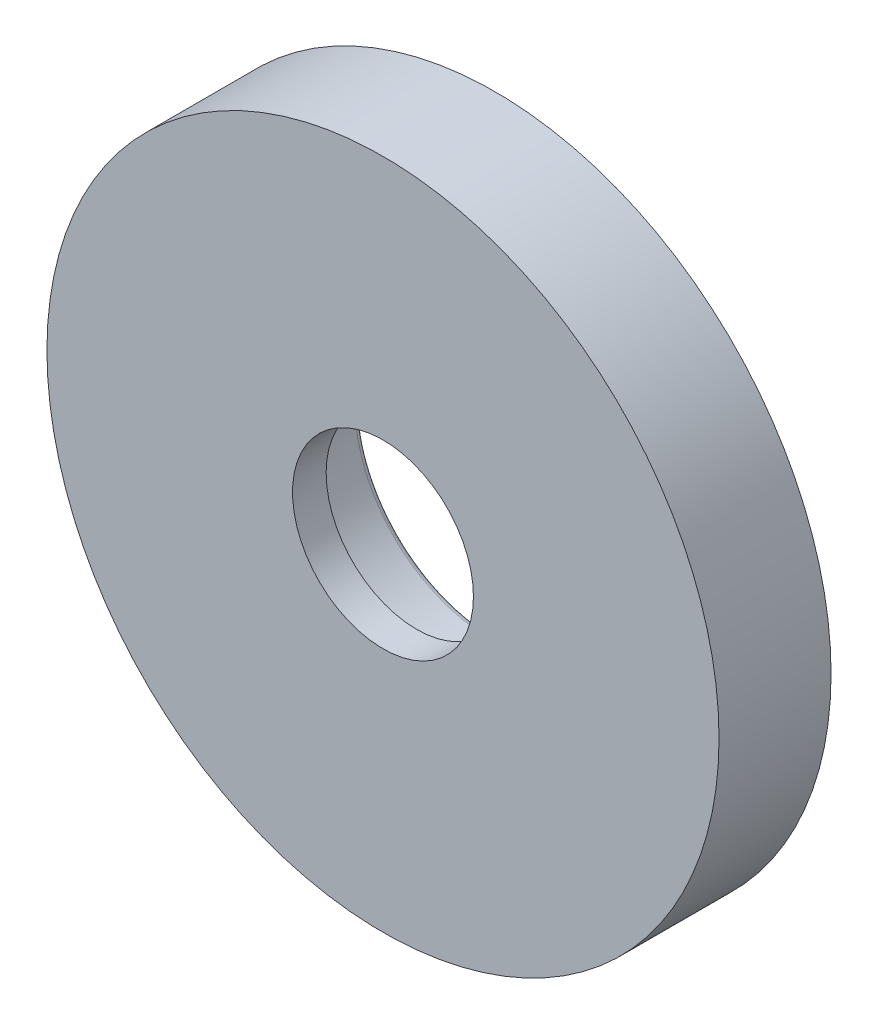
from build123d import *

# Parameters (mm, degrees)
SKETCH1_R               = 15
BOSS_EXTRUDE1_DEPTH     = 5
CUT_EXTRUDE1_DEPTH      = 3.125
BOSS_EXTRUDE4_START     = 3.125
BOSS_EXTRUDE4_DEPTH     = 3.125
CIRPATTERN1_COUNT       = 4
SKETCH4_R               = 6
CUT_EXTRUDE2_DEPTH      = 3.5
FILLET1_R               = 0.25
CUT_EXTRUDE3_DEPTH      = 22.794494718
CUT_EXTRUDE3_DEPTH_BACK = 22.794494718
SKETCH5_R               = 4.0375
FILLET2_R               = 0.5


with BuildPart() as part:
    # Sketch1 → Boss-Extrude1 (new body)
    with BuildSketch(Plane.XY):
        Circle(SKETCH1_R)
    extrude(amount=BOSS_EXTRUDE1_DEPTH)

    # Sketch1<5> → Cut-Extrude1 (cut)
    with BuildSketch(Plane.XY):
        with BuildLine():
            ThreePointArc((-2.469224322, 13.9075), (-4.680749466, 13.326897968), (-6.769624128, 12.397088939))
            Line((-6.769624128, 12.397088939), (-6.769624128, 8.9075))
            Line((-6.769624128, 8.9075), (6.769624128, 8.9075))
            Line((6.769624128, 8.9075), (6.769624128, 12.397088939))
            ThreePointArc((6.769624128, 12.397088939), (4.680749466, 13.326897968), (2.469224322, 13.9075))
            Line((2.469224322, 13.9075), (-2.469224322, 13.9075))
        make_face()
    cut_extrude1 = extrude(amount=CUT_EXTRUDE1_DEPTH, mode=Mode.SUBTRACT)

    # Sketch7 → Boss-Extrude4 (add)
    with BuildSketch(Plane(origin=(0, 0, 3.125), x_dir=(-1, 0, 0), z_dir=(0, 0, -1)).offset(BOSS_EXTRUDE4_START)):
        with BuildLine():
            ThreePointArc((-2.469224322, 13.9075), (-4.680749466, 13.326897968), (-6.769624128, 12.397088939))
            Line((-6.769624128, 12.397088939), (-6.769624128, 8.9075))
            Line((-6.769624128, 8.9075), (6.769624128, 8.9075))
            Line((6.769624128, 8.9075), (6.769624128, 12.397088939))
            ThreePointArc((6.769624128, 12.397088939), (4.680749466, 13.326897968), (2.469224322, 13.9075))
            Line((2.469224322, 13.9075), (-2.469224322, 13.9075))
        make_face()
        with BuildLine():
            Line((-6.644624128, 9.0325), (-6.644624128, 12.322701416))
            ThreePointArc((-6.644624128, 12.322701416), (-4.609561284, 13.219377624), (-2.45818912, 13.7825))
            Line((-2.45818912, 13.7825), (2.45818912, 13.7825))
            ThreePointArc((2.45818912, 13.7825), (4.609561284, 13.219377624), (6.644624128, 12.322701416))
            Line((6.644624128, 12.322701416), (6.644624128, 9.0325))
            Line((6.644624128, 9.0325), (-6.644624128, 9.0325))
        make_face(mode=Mode.SUBTRACT)
    boss_extrude4 = extrude(amount=-BOSS_EXTRUDE4_DEPTH)

    # CirPattern1: Cut-Extrude1, Boss-Extrude4 ×4 about axis
    cirpattern1_axis = Axis((0, 0, -0.25), (0, 0, 1))
    add([cut_extrude1.rotate(cirpattern1_axis, i * 360 / CIRPATTERN1_COUNT) for i in range(1, CIRPATTERN1_COUNT)], mode=Mode.SUBTRACT)
    add([boss_extrude4.rotate(cirpattern1_axis, i * 360 / CIRPATTERN1_COUNT) for i in range(1, CIRPATTERN1_COUNT)])

    # Sketch4 → Cut-Extrude2 (cut)
    with BuildSketch(Plane(origin=(0, 0, 0), x_dir=(-1, 0, 0), z_dir=(0, 0, -1))):
        Circle(SKETCH4_R)
    extrude(amount=-CUT_EXTRUDE2_DEPTH, mode=Mode.SUBTRACT)

    # Fillet1
    fillet1_edges = [part.edges().sort_by_distance(p)[0] for p in [
        (6, 0, 0),
    ]]
    fillet(fillet1_edges, radius=FILLET1_R)

    # Sketch5 → Cut-Extrude3 (cut, two sides: drawn at the far end of the back side and taken through both)
    with BuildSketch(Plane.XY.offset(5).offset(-CUT_EXTRUDE3_DEPTH_BACK)):
        Circle(SKETCH5_R)
    extrude(amount=CUT_EXTRUDE3_DEPTH + CUT_EXTRUDE3_DEPTH_BACK, mode=Mode.SUBTRACT)

    # Fillet2
    fillet2_edges = [part.edges().sort_by_distance(p)[0] for p in [
        (12.322701416, -6.644624128, 1.5625),
        (9.0325, -6.644624128, 1.5625),
        (9.0325, 6.644624128, 1.5625),
        (12.322701416, 6.644624128, 1.5625),
        (13.7825, 2.45818912, 1.5625),
        (13.7825, -2.45818912, 1.5625),
        (-6.644624128, -12.322701416, 1.5625),
        (-6.644624128, -9.0325, 1.5625),
        (6.644624128, -9.0325, 1.5625),
        (6.644624128, -12.322701416, 1.5625),
        (2.45818912, -13.7825, 1.5625),
        (-2.45818912, -13.7825, 1.5625),
        (-12.322701416, 6.644624128, 1.5625),
        (-9.0325, 6.644624128, 1.5625),
        (-9.0325, -6.644624128, 1.5625),
        (-12.322701416, -6.644624128, 1.5625),
        (-13.7825, -2.45818912, 1.5625),
        (-13.7825, 2.45818912, 1.5625),
        (6.644624128, 9.0325, 1.5625),
        (-6.644624128, 9.0325, 1.5625),
        (-6.644624128, 12.322701416, 1.5625),
        (-2.45818912, 13.7825, 1.5625),
        (2.45818912, 13.7825, 1.5625),
        (6.644624128, 12.322701416, 1.5625),
    ]]
    fillet(fillet2_edges, radius=FILLET2_R)


solid = part.part
